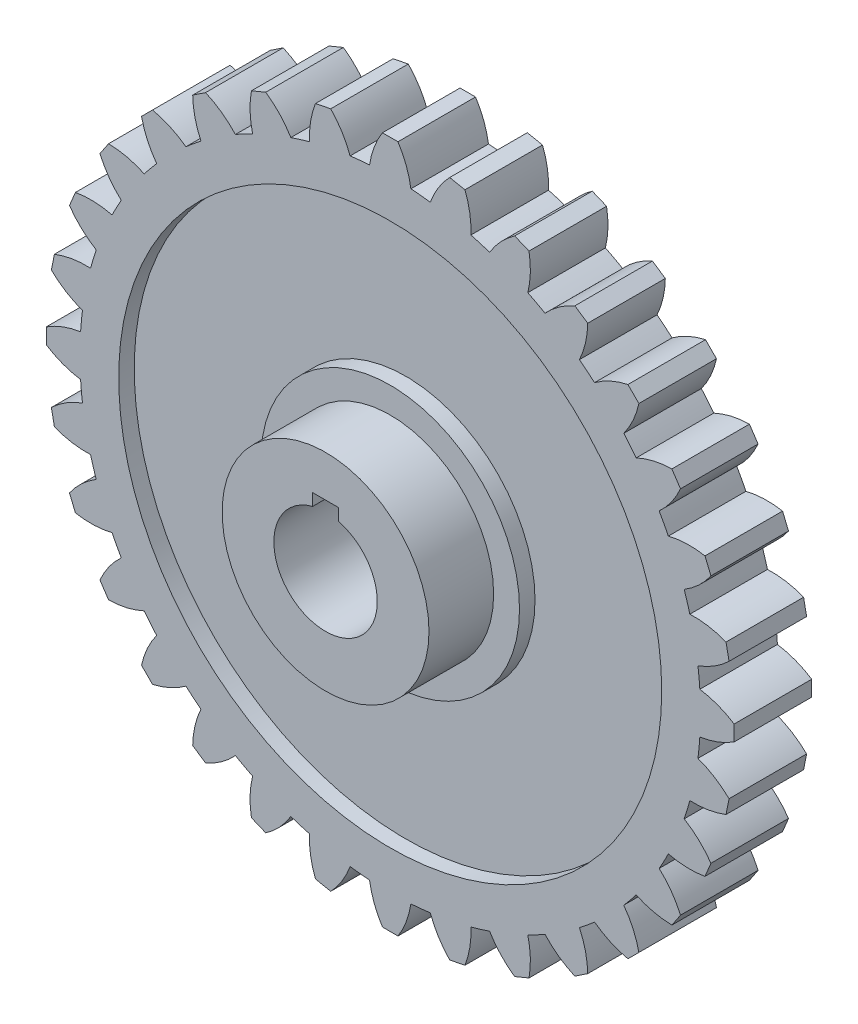
from build123d import *

# Parameters (mm, degrees)
SKETCH1_R           = 60
BOSS_EXTRUDE1_DEPTH = 7.5
BOSS_EXTRUDE2_DEPTH = 15
CIRPATTERN1_COUNT   = 32
SKETCH3_R           = 20
BOSS_EXTRUDE3_DEPTH = 20
CUT_EXTRUDE1_DEPTH  = 103.198336581
CUT_EXTRUDE2_START  = 7.5
SKETCH5_R           = 52.5
SKETCH5_R_2         = 25
CUT_EXTRUDE2_DEPTH  = 3


with BuildPart() as part:
    # Sketch1 → Boss-Extrude1 (new, symmetric)
    with BuildSketch(Plane.XY):
        Circle(SKETCH1_R)
    extrude(amount=BOSS_EXTRUDE1_DEPTH, both=True)

    # Sketch2 → Boss-Extrude2 (add)
    with BuildSketch(Plane.XY.offset(7.5)):
        with BuildLine():
            Line((-1.5, 66.5), (1.5, 66.5))
            ThreePointArc((1.5, 66.5), (3.099609074, 63.315018359), (4, 59.866518188))
            ThreePointArc((4, 59.866518188), (0, 60), (-4, 59.866518188))
            ThreePointArc((-4, 59.866518188), (-3.099609074, 63.315018359), (-1.5, 66.5))
        make_face()
    boss_extrude2 = extrude(amount=-BOSS_EXTRUDE2_DEPTH)

    # CirPattern1: Boss-Extrude2 ×32 about axis
    cirpattern1_axis = Axis((0, 0, 0), (0, 0, 1))
    for i in range(1, CIRPATTERN1_COUNT):
        add(boss_extrude2.rotate(cirpattern1_axis, i * 360 / CIRPATTERN1_COUNT))

    # Sketch3 → Boss-Extrude3 (add, symmetric)
    with BuildSketch(Plane.XY):
        Circle(SKETCH3_R)
    extrude(amount=BOSS_EXTRUDE3_DEPTH, both=True)

    # Sketch4 → Cut-Extrude1 (cut, through all)
    with BuildSketch(Plane.XY.offset(20)):
        with BuildLine():
            Line((-2.5, 12), (2.5, 12))
            Line((2.5, 12), (2.5, 9.682458366))
            ThreePointArc((2.5, 9.682458366), (0, -10), (-2.5, 9.682458366))
            Line((-2.5, 9.682458366), (-2.5, 12))
        make_face()
    extrude(amount=-CUT_EXTRUDE1_DEPTH, mode=Mode.SUBTRACT)

    # Sketch5 → Cut-Extrude2 (cut)
    with BuildSketch(Plane.XY.offset(CUT_EXTRUDE2_START)):
        Circle(SKETCH5_R)
        Circle(SKETCH5_R_2, mode=Mode.SUBTRACT)
    cut_extrude2 = extrude(amount=-CUT_EXTRUDE2_DEPTH, mode=Mode.SUBTRACT)

    # Mirror1: Cut-Extrude2 across plane
    add(cut_extrude2.mirror(Plane.XY), mode=Mode.SUBTRACT)


solid = part.part
